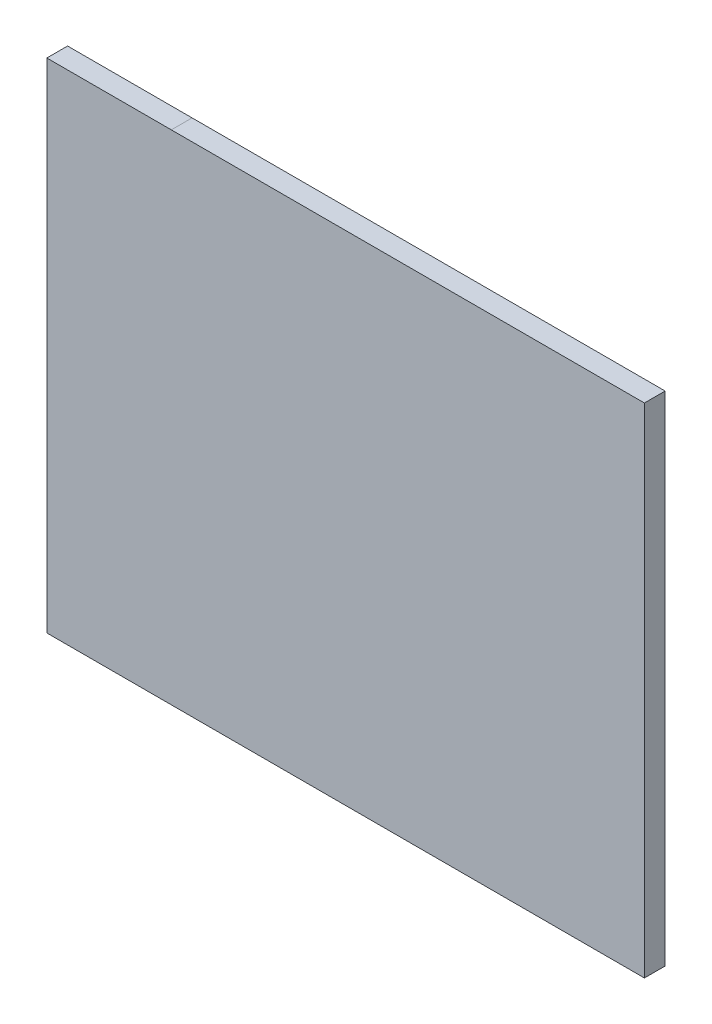
from build123d import *

# Parameters (mm, degrees)
SKETCH1_W      = 7315.2
SKETCH1_H      = 6096
EXTRUDE1_DEPTH = 254


with BuildPart() as part:
    # Sketch1 → Extrude1 (new body)
    with BuildSketch(Plane.XY):
        with Locations((3657.6, -2946.4)):
            Rectangle(SKETCH1_W, SKETCH1_H)
    extrude(amount=EXTRUDE1_DEPTH)


solid = part.part
